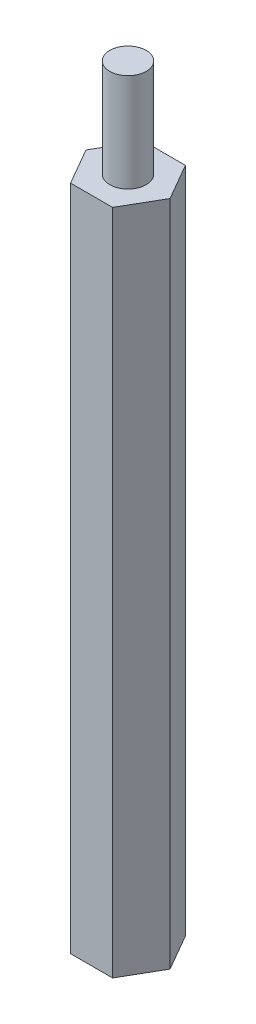
from build123d import *

# Parameters (mm, degrees)
BOSS_EXTRUDE1_DEPTH = 55
SKETCH5_R           = 1.5
BOSS_EXTRUDE2_DEPTH = 8.091605471
SKETCH6_R           = 1.5
CUT_EXTRUDE1_DEPTH  = 4


with BuildPart() as part:
    # Sketch3 → Boss-Extrude1 (new body)
    with BuildSketch(Plane(origin=(0, 0, 0), x_dir=(1, 0, 0), z_dir=(0, 1, 0))):
        Polygon((-3.464101615, 0), (-1.732050808, -3), (1.732050808, -3), (3.464101615, 0), (1.732050808, 3), (-1.732050808, 3), align=None)
    extrude(amount=BOSS_EXTRUDE1_DEPTH)

    # Sketch5 → Boss-Extrude2 (add)
    with BuildSketch(Plane(origin=(0, 55, 0), x_dir=(1, 0, 0), z_dir=(0, 1, 0))):
        with Locations(Location((0, 0, 0), (0, 0, 270))):
            Circle(SKETCH5_R)
    extrude(amount=BOSS_EXTRUDE2_DEPTH)

    # Sketch6 → Cut-Extrude1 (cut)
    with BuildSketch(Plane.XZ):
        with Locations(Location((0, 0, 0), (0, 0, 90))):
            Circle(SKETCH6_R)
    extrude(amount=-CUT_EXTRUDE1_DEPTH, mode=Mode.SUBTRACT)


solid = part.part
